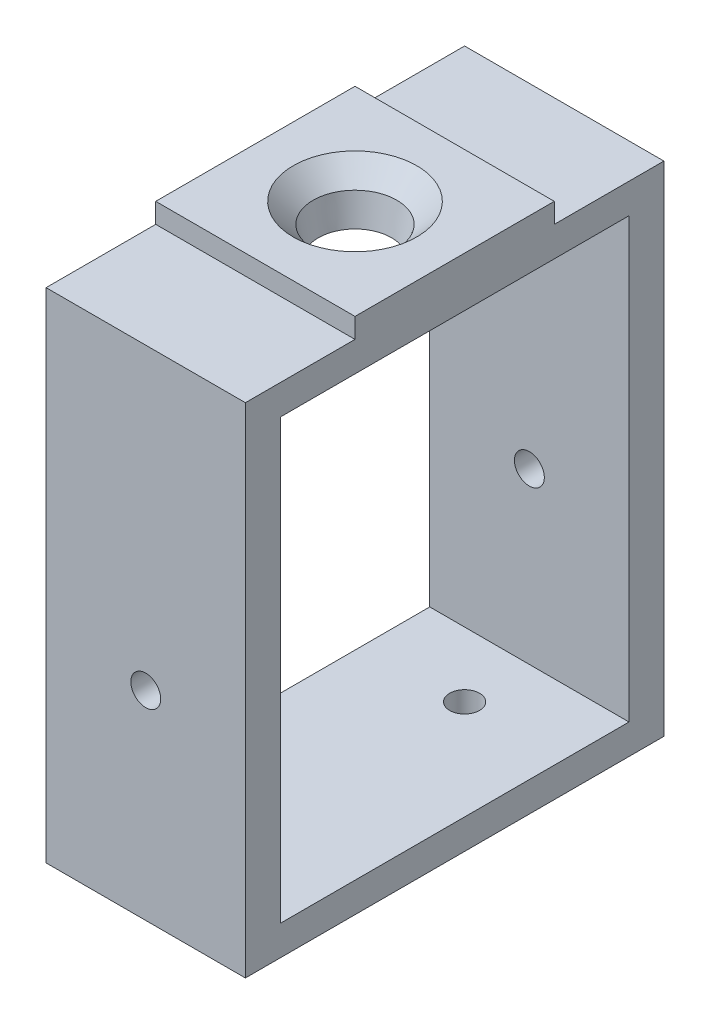
from build123d import *

# Parameters (mm, degrees)
SKETCH_1_W          = 20
SKETCH_1_H          = 42
EXTRUDE_1_DEPTH     = 3
SKETCH_2_W          = 20
SKETCH_2_H          = 3.5
EXTRUDE_2_DEPTH     = 47
SKETCH_3_R          = 1.5
CUT_EXTRUDE_1_DEPTH = 69.293484316
SKETCH_4_W          = 35
SKETCH_4_H          = 3
EXTRUDE_3_DEPTH     = 20
SKETCH_8_W          = 20
SKETCH_8_H          = 20
EXTRUDE_5_DEPTH     = 2
SKETCH_9_R          = 6.2
CUT_EXTRUDE_4_DEPTH = 2
CUT_EXTRUDE_4_DRAFT = -45
SKETCH_10_R         = 4.2
CUT_EXTRUDE_5_DEPTH = 3
CUT_EXTRUDE_5_DRAFT = -10
SKETCH_11_R         = 1.5
CUT_EXTRUDE_6_DEPTH = 3


with BuildPart() as part:
    # 草图1 → 凸台-拉伸1 (new body)
    with BuildSketch(Plane(origin=(0, 0, 0), x_dir=(1, 0, 0), z_dir=(0, 1, 0))):
        with Locations((10, -21)):
            Rectangle(SKETCH_1_W, SKETCH_1_H)
    extrude(amount=EXTRUDE_1_DEPTH)

    # 草图2 → 凸台-拉伸2 (add)
    with BuildSketch(Plane(origin=(0, 3, 0), x_dir=(1, 0, 0), z_dir=(0, 1, 0))):
        with Locations((10, -40.25)):
            Rectangle(SKETCH_2_W, SKETCH_2_H)
        with Locations((10, -1.75)):
            Rectangle(SKETCH_2_W, SKETCH_2_H)
    extrude(amount=EXTRUDE_2_DEPTH)

    # 草图3 → 切除-拉伸1 (cut, through all)
    with BuildSketch(Plane.XY.offset(42)):
        with Locations((10, 20)):
            Circle(SKETCH_3_R)
    extrude(amount=-CUT_EXTRUDE_1_DEPTH, mode=Mode.SUBTRACT)

    # 草图4 → 凸台-拉伸3 (add)
    with BuildSketch(Plane(origin=(20, 0, 0), x_dir=(0, 0, -1), z_dir=(1, 0, 0))):
        with Locations((-21, 48.5)):
            Rectangle(SKETCH_4_W, SKETCH_4_H)
    extrude(amount=-EXTRUDE_3_DEPTH)

    # 草图8 → 凸台-拉伸5 (add)
    with BuildSketch(Plane(origin=(0, 50, 0), x_dir=(1, 0, 0), z_dir=(0, 1, 0))):
        with Locations((10, -21)):
            Rectangle(SKETCH_8_W, SKETCH_8_H)
    extrude(amount=EXTRUDE_5_DEPTH)


with BuildPart() as cut_extrude_4_tool:
    # 草图9 → 切除-拉伸4 (with draft: the straight prism first)
    with BuildSketch(Plane(origin=(0, 52, 0), x_dir=(1, 0, 0), z_dir=(0, 1, 0))):
        with Locations((10, -21)):
            Circle(SKETCH_9_R)
    extrude(amount=-CUT_EXTRUDE_4_DEPTH)
    # 切除-拉伸4: the draft: its side faces are tilted about the plane it starts from
    cut_extrude_4_sides = [cut_extrude_4_tool.faces().sort_by_distance(p)[0] for p in [
        (3.8, 51, 21),
    ]]
    draft(cut_extrude_4_sides, Plane(origin=(0, 52, 0), x_dir=(1, 0, 0), z_dir=(0, 1, 0)), CUT_EXTRUDE_4_DRAFT)


with BuildPart() as part_1:
    add(part.part)

    # 切除-拉伸4: cut by cut_extrude_4_tool
    add(cut_extrude_4_tool.part, mode=Mode.SUBTRACT)


with BuildPart() as cut_extrude_5_tool:
    # 草图10 → 切除-拉伸5 (with draft: the straight prism first)
    with BuildSketch(Plane(origin=(0, 50, 0), x_dir=(1, 0, 0), z_dir=(0, 1, 0))):
        with Locations((10, -21)):
            Circle(SKETCH_10_R)
    extrude(amount=-CUT_EXTRUDE_5_DEPTH)
    # 切除-拉伸5: the draft: its side faces are tilted about the plane it starts from
    cut_extrude_5_sides = [cut_extrude_5_tool.faces().sort_by_distance(p)[0] for p in [
        (5.8, 48.5, 21),
    ]]
    draft(cut_extrude_5_sides, Plane(origin=(0, 50, 0), x_dir=(1, 0, 0), z_dir=(0, 1, 0)), CUT_EXTRUDE_5_DRAFT)


with BuildPart() as part_2:
    add(part_1.part)

    # 切除-拉伸5: cut by cut_extrude_5_tool
    add(cut_extrude_5_tool.part, mode=Mode.SUBTRACT)

    # 草图11 → 切除-拉伸6 (cut)
    with BuildSketch(Plane(origin=(0, 0, 0), x_dir=(-1, 0, 0), z_dir=(0, -1, 0))):
        with Locations(Location((-10, -32, 0), (0, 0, 90))):
            Circle(SKETCH_11_R)
        with Locations(Location((-10, -10, 0), (0, 0, 90))):
            Circle(SKETCH_11_R)
    extrude(amount=-CUT_EXTRUDE_6_DEPTH, mode=Mode.SUBTRACT)


solid = part_2.part
